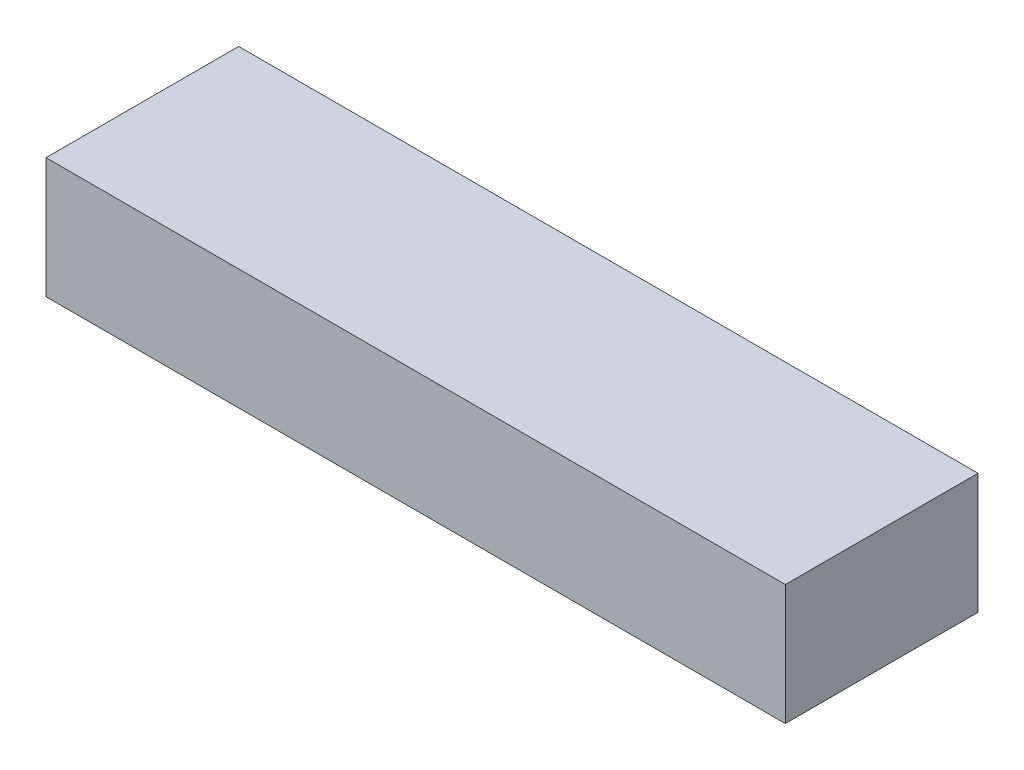
from build123d import *

# Parameters (mm, degrees)
SKETCH1_W           = 116.1796
SKETCH1_H           = 30.2768
BOSS_EXTRUDE1_DEPTH = 18.923


with BuildPart() as part:
    # Sketch1 → Boss-Extrude1 (new body)
    with BuildSketch(Plane(origin=(0, 0, 0), x_dir=(1, 0, 0), z_dir=(0, 1, 0))):
        with Locations((58.0898, 15.1384)):
            Rectangle(SKETCH1_W, SKETCH1_H)
    extrude(amount=BOSS_EXTRUDE1_DEPTH)


solid = part.part
